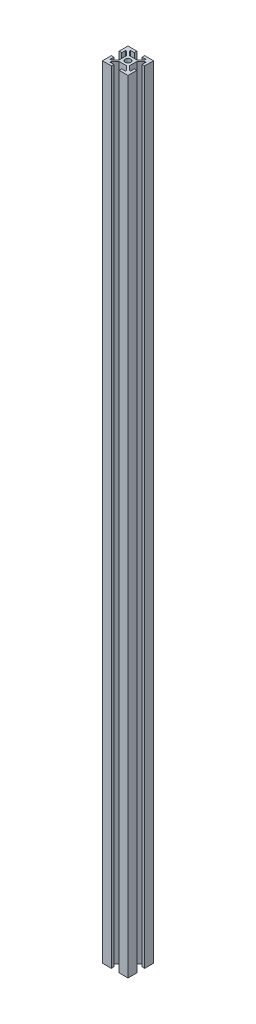
from build123d import *

# Parameters (mm, degrees)
SKETCH_1_R          = 2.15
EXTRUDE_1_DEPTH     = 612.6
SKETCH_3_R          = 3
CUT_EXTRUDE_1_DEPTH = 26


with BuildPart() as part:
    # 스케치1 → 보스-돌출1 (new body)
    with BuildSketch(Plane(origin=(0, 0, 0), x_dir=(1, 0, 0), z_dir=(0, 1, 0))):
        Polygon((3.1, 8), (6, 8), (6, 7), (3, 4), (0, 4), (-3, 4), (-6, 7), (-6, 8), (-3.1, 8), (-3.1, 9.998992087), (-10.001007855, 9.998992087), (-10.001007855, 3.1), (-8, 3.1), (-8, 6), (-7, 6), (-4, 3), (-4, 0), (-4, -3), (-7, -6), (-8, -6), (-8, -3.1), (-10.001007855, -3.1), (-10.001007855, -9.998992087), (-3.1, -9.998992087), (-3.1, -8), (-6, -8), (-6, -7), (-3, -4), (0, -4), (3, -4), (6, -7), (6, -8), (3.1, -8), (3.1, -9.998992087), (10.001007855, -9.998992087), (10.001007855, -3.1), (8, -3.1), (8, -6), (7, -6), (4, -3), (4, 0), (4, 3), (7, 6), (8, 6), (8, 3.1), (10.001007855, 3.1), (10.001007855, 9.998992087), (3.1, 9.998992087), align=None)
        with Locations(Location((0, 0, 0), (0, 0, 270))):
            Circle(SKETCH_1_R, mode=Mode.SUBTRACT)
    extrude(amount=EXTRUDE_1_DEPTH)

    # 스케치3 → 컷-돌출1 (cut)
    with BuildSketch(Plane(origin=(10.001007855, 0, 0), x_dir=(0, 0, -1), z_dir=(1, 0, 0))):
        with Locations((0, 306.3)):
            Circle(SKETCH_3_R)
    extrude(amount=-CUT_EXTRUDE_1_DEPTH, mode=Mode.SUBTRACT)


solid = part.part
